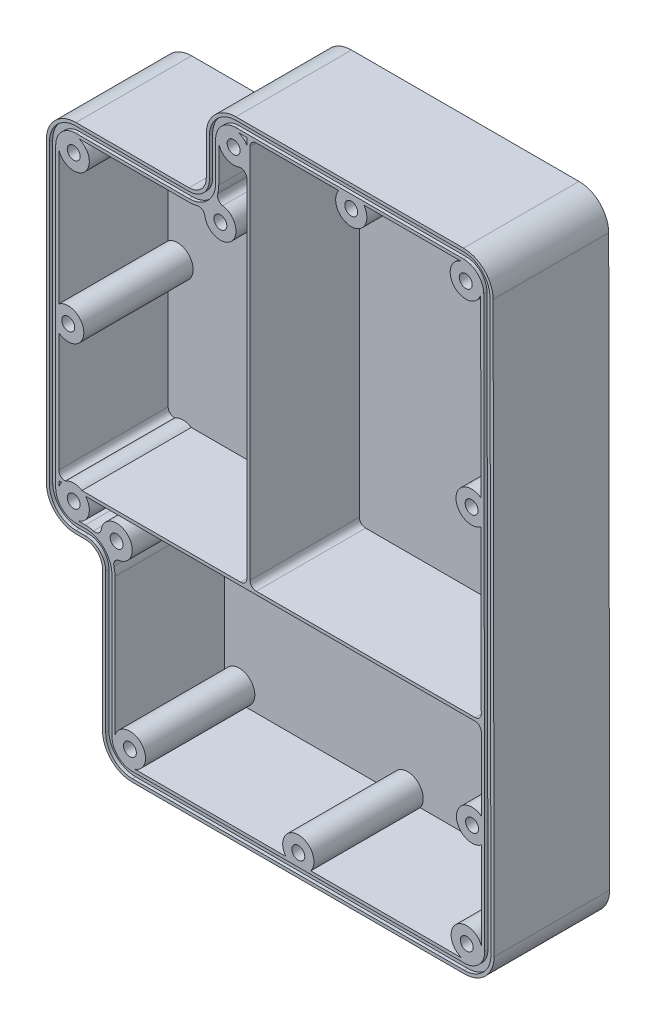
from build123d import *

# Parameters (mm, degrees)
BOSS_EXTRUDE1_DEPTH = 44.45
SHELL1_T            = 2.54
CUT_EXTRUDE1_START  = -1.3208
CUT_EXTRUDE1_DEPTH  = 1.3208
BOSS_EXTRUDE2_DEPTH = 43.1292
BOSS_EXTRUDE3_DEPTH = 44.45
SKETCH11_R          = 2.625
BOSS_EXTRUDE4_DEPTH = 44.45
BOSS_EXTRUDE5_DEPTH = 44.45
FILLET1_R           = 2.54


with BuildPart() as part:
    # Sketch7 → Boss-Extrude1 (new body)
    with BuildSketch(Plane.XY):
        with BuildLine():
            Line((1.400091904, 161.024877954), (93.909764591, 161.024877954))
            ThreePointArc((93.909764591, 161.024877954), (100.639255199, 158.240766705), (103.434750952, 151.515997357))
            Line((103.434750952, 151.515997357), (103.826115978, -79.742350851))
            ThreePointArc((103.826115978, -79.742350851), (101.042018369, -86.487960862), (94.301129617, -89.283470254))
            Line((94.301129617, -89.283470254), (-40.771402015, -89.283470254))
            ThreePointArc((-40.771402015, -89.283470254), (-47.506594106, -86.493662345), (-50.296402015, -79.758470254))
            Line((-50.296402015, -79.758470254), (-50.296402015, -22.862468667))
            ThreePointArc((-50.296402015, -22.862468667), (-53.086209924, -16.127276576), (-59.821402015, -13.337468667))
            Line((-59.821402015, -13.337468667), (-63.623905441, -13.337468667))
            ThreePointArc((-63.623905441, -13.337468667), (-70.359097532, -10.547660758), (-73.148905441, -3.812468667))
            Line((-73.148905441, -3.812468667), (-73.148905441, 116.964531455))
            ThreePointArc((-73.148905441, 116.964531455), (-70.359097532, 123.699723546), (-63.623905441, 126.489531455))
            Line((-63.623905441, 126.489531455), (-17.649908096, 126.489531455))
            ThreePointArc((-17.649908096, 126.489531455), (-10.914716005, 129.279339364), (-8.124908096, 136.014531455))
            Line((-8.124908096, 136.014531455), (-8.124908096, 151.499877954))
            ThreePointArc((-8.124908096, 151.499877954), (-5.335100187, 158.235070045), (1.400091904, 161.024877954))
        make_face()
    extrude(amount=BOSS_EXTRUDE1_DEPTH)

    # Shell1
    shell1_openings = [part.faces().sort_by_distance(p)[0] for p in [
        (21.682405535, 33.552782765, 44.45),
    ]]
    offset(amount=SHELL1_T, openings=shell1_openings, kind=Kind.INTERSECTION)

    # Sketch8 → Cut-Extrude1 (cut)
    with BuildSketch(Plane.XY.offset(44.45).offset(CUT_EXTRUDE1_START)):
        with BuildLine():
            Line((-9.394908096, 151.499877954), (-9.394908096, 136.014531455))
            ThreePointArc((-9.394908096, 136.014531455), (-11.812741617, 130.177364976), (-17.649908096, 127.759531455))
            Line((-17.649908096, 127.759531455), (-63.623905441, 127.759531455))
            ThreePointArc((-63.623905441, 127.759531455), (-71.257123144, 124.597749158), (-74.418905441, 116.964531455))
            Line((-74.418905441, 116.964531455), (-74.418905441, -3.812468667))
            ThreePointArc((-74.418905441, -3.812468667), (-71.257123144, -11.44568637), (-63.623905441, -14.607468667))
            Line((-63.623905441, -14.607468667), (-59.821402015, -14.607468667))
            ThreePointArc((-59.821402015, -14.607468667), (-53.984235537, -17.025302189), (-51.566402015, -22.862468667))
            Line((-51.566402015, -22.862468667), (-51.566402015, -79.758470254))
            ThreePointArc((-51.566402015, -79.758470254), (-48.404619718, -87.391687957), (-40.771402015, -90.553470254))
            Line((-40.771402015, -90.553470254), (94.301129617, -90.553470254))
            ThreePointArc((94.301129617, -90.553470254), (101.940803536, -87.385226277), (105.096114159, -79.740201597))
            Line((105.096114159, -79.740201597), (104.704749133, 151.518146611))
            ThreePointArc((104.704749133, 151.518146611), (101.536520614, 159.139551872), (93.909764591, 162.294877954))
            Line((93.909764591, 162.294877954), (1.400091904, 162.294877954))
            ThreePointArc((1.400091904, 162.294877954), (-6.233125799, 159.133095657), (-9.394908096, 151.499877954))
        make_face()
        with BuildLine():
            Line((-8.124908096, 151.499877954), (-8.124908096, 136.014531455))
            ThreePointArc((-8.124908096, 136.014531455), (-10.914716005, 129.279339364), (-17.649908096, 126.489531455))
            Line((-17.649908096, 126.489531455), (-63.623905441, 126.489531455))
            ThreePointArc((-63.623905441, 126.489531455), (-70.359097532, 123.699723546), (-73.148905441, 116.964531455))
            Line((-73.148905441, 116.964531455), (-73.148905441, -3.812468667))
            ThreePointArc((-73.148905441, -3.812468667), (-70.359097532, -10.547660758), (-63.623905441, -13.337468667))
            Line((-63.623905441, -13.337468667), (-59.821402015, -13.337468667))
            ThreePointArc((-59.821402015, -13.337468667), (-53.086209924, -16.127276576), (-50.296402015, -22.862468667))
            Line((-50.296402015, -22.862468667), (-50.296402015, -79.758470254))
            ThreePointArc((-50.296402015, -79.758470254), (-47.506594106, -86.493662345), (-40.771402015, -89.283470254))
            Line((-40.771402015, -89.283470254), (94.301129617, -89.283470254))
            ThreePointArc((94.301129617, -89.283470254), (101.042018369, -86.487960862), (103.826115978, -79.742350851))
            Line((103.826115978, -79.742350851), (103.434750952, 151.515997357))
            ThreePointArc((103.434750952, 151.515997357), (100.639255199, 158.240766705), (93.909764591, 161.024877954))
            Line((93.909764591, 161.024877954), (1.400091904, 161.024877954))
            ThreePointArc((1.400091904, 161.024877954), (-5.335100187, 158.235070045), (-8.124908096, 151.499877954))
        make_face(mode=Mode.SUBTRACT)
    extrude(amount=CUT_EXTRUDE1_DEPTH, mode=Mode.SUBTRACT)

    # Sketch9 → Boss-Extrude2 (add)
    with BuildSketch(Plane.XY):
        with BuildLine():
            Line((-40.771402015, -89.283470254), (94.301129617, -89.283470254))
            ThreePointArc((94.301129617, -89.283470254), (101.042018369, -86.487960862), (103.826115978, -79.742350851))
            Line((103.826115978, -79.742350851), (103.434750952, 151.515997357))
            ThreePointArc((103.434750952, 151.515997357), (100.639255199, 158.240766705), (93.909764591, 161.024877954))
            Line((93.909764591, 161.024877954), (1.400091904, 161.024877954))
            ThreePointArc((1.400091904, 161.024877954), (-5.335100187, 158.235070045), (-8.124908096, 151.499877954))
            Line((-8.124908096, 151.499877954), (-8.124908096, 136.014531455))
            ThreePointArc((-8.124908096, 136.014531455), (-10.914716005, 129.279339364), (-17.649908096, 126.489531455))
            Line((-17.649908096, 126.489531455), (-63.623905441, 126.489531455))
            ThreePointArc((-63.623905441, 126.489531455), (-70.359097532, 123.699723546), (-73.148905441, 116.964531455))
            Line((-73.148905441, 116.964531455), (-73.148905441, -3.812468667))
            ThreePointArc((-73.148905441, -3.812468667), (-70.359097532, -10.547660758), (-63.623905441, -13.337468667))
            Line((-63.623905441, -13.337468667), (-59.821402015, -13.337468667))
            ThreePointArc((-59.821402015, -13.337468667), (-53.086209924, -16.127276576), (-50.296402015, -22.862468667))
            Line((-50.296402015, -22.862468667), (-50.296402015, -79.758470254))
            ThreePointArc((-50.296402015, -79.758470254), (-47.506594106, -86.493662345), (-40.771402015, -89.283470254))
        make_face()
        with BuildLine():
            Line((-40.771402015, -88.013470254), (94.301129617, -88.013470254))
            ThreePointArc((94.301129617, -88.013470254), (100.143233202, -85.590695448), (102.556117796, -79.744500105))
            Line((102.556117796, -79.744500105), (102.16475277, 151.513848103))
            ThreePointArc((102.16475277, 151.513848103), (99.741989785, 157.341981538), (93.909764591, 159.754877954))
            Line((93.909764591, 159.754877954), (1.400091904, 159.754877954))
            ThreePointArc((1.400091904, 159.754877954), (-4.437074575, 157.337044433), (-6.854908096, 151.499877954))
            Line((-6.854908096, 151.499877954), (-6.854908096, 136.014531455))
            ThreePointArc((-6.854908096, 136.014531455), (-10.016690393, 128.381313752), (-17.649908096, 125.219531455))
            Line((-17.649908096, 125.219531455), (-63.623905441, 125.219531455))
            ThreePointArc((-63.623905441, 125.219531455), (-69.46107192, 122.801697934), (-71.878905441, 116.964531455))
            Line((-71.878905441, 116.964531455), (-71.878905441, -3.812468667))
            ThreePointArc((-71.878905441, -3.812468667), (-69.46107192, -9.649635146), (-63.623905441, -12.067468667))
            Line((-63.623905441, -12.067468667), (-59.821402015, -12.067468667))
            ThreePointArc((-59.821402015, -12.067468667), (-52.188184312, -15.229250964), (-49.026402015, -22.862468667))
            Line((-49.026402015, -22.862468667), (-49.026402015, -79.758470254))
            ThreePointArc((-49.026402015, -79.758470254), (-46.608568494, -85.595636733), (-40.771402015, -88.013470254))
        make_face(mode=Mode.SUBTRACT)
    extrude(amount=BOSS_EXTRUDE2_DEPTH)

    # Sketch10 → Boss-Extrude3 (add)
    with BuildSketch(Plane.XY):
        with BuildLine():
            Line((-40.771402015, -88.013470254), (94.301129617, -88.013470254))
            ThreePointArc((94.301129617, -88.013470254), (100.143233202, -85.590695448), (102.556117796, -79.744500105))
            Line((102.556117796, -79.744500105), (102.16475277, 151.513848103))
            ThreePointArc((102.16475277, 151.513848103), (99.741989785, 157.341981538), (93.909764591, 159.754877954))
            Line((93.909764591, 159.754877954), (1.400091904, 159.754877954))
            ThreePointArc((1.400091904, 159.754877954), (-4.437074575, 157.337044433), (-6.854908096, 151.499877954))
            Line((-6.854908096, 151.499877954), (-6.854908096, 136.014531455))
            ThreePointArc((-6.854908096, 136.014531455), (-10.016690393, 128.381313752), (-17.649908096, 125.219531455))
            Line((-17.649908096, 125.219531455), (-63.623905441, 125.219531455))
            ThreePointArc((-63.623905441, 125.219531455), (-69.46107192, 122.801697934), (-71.878905441, 116.964531455))
            Line((-71.878905441, 116.964531455), (-71.878905441, -3.812468667))
            ThreePointArc((-71.878905441, -3.812468667), (-69.46107192, -9.649635146), (-63.623905441, -12.067468667))
            Line((-63.623905441, -12.067468667), (-59.821402015, -12.067468667))
            ThreePointArc((-59.821402015, -12.067468667), (-52.188184312, -15.229250964), (-49.026402015, -22.862468667))
            Line((-49.026402015, -22.862468667), (-49.026402015, -79.758470254))
            ThreePointArc((-49.026402015, -79.758470254), (-46.608568494, -85.595636733), (-40.771402015, -88.013470254))
        make_face()
        with BuildLine():
            Line((-47.756402015, -22.862468667), (-47.756402015, -79.758470254))
            ThreePointArc((-47.756402015, -79.758470254), (-45.710542882, -84.697611121), (-40.771402015, -86.743470254))
            Line((-40.771402015, -86.743470254), (94.301129617, -86.743470254))
            ThreePointArc((94.301129617, -86.743470254), (99.244448035, -84.693430033), (101.286119615, -79.746649359))
            Line((101.286119615, -79.746649359), (100.894754589, 151.51169885))
            ThreePointArc((100.894754589, 151.51169885), (98.84472437, 156.443196372), (93.909764591, 158.484877954))
            Line((93.909764591, 158.484877954), (1.400091904, 158.484877954))
            ThreePointArc((1.400091904, 158.484877954), (-3.539048963, 156.439018821), (-5.584908096, 151.499877954))
            Line((-5.584908096, 151.499877954), (-5.584908096, 136.014531455))
            ThreePointArc((-5.584908096, 136.014531455), (-9.118664781, 127.48328814), (-17.649908096, 123.949531455))
            Line((-17.649908096, 123.949531455), (-63.623905441, 123.949531455))
            ThreePointArc((-63.623905441, 123.949531455), (-68.563046308, 121.903672321), (-70.608905441, 116.964531455))
            Line((-70.608905441, 116.964531455), (-70.608905441, -3.812468667))
            ThreePointArc((-70.608905441, -3.812468667), (-68.563046308, -8.751609534), (-63.623905441, -10.797468667))
            Line((-63.623905441, -10.797468667), (-59.821402015, -10.797468667))
            ThreePointArc((-59.821402015, -10.797468667), (-51.2901587, -14.331225352), (-47.756402015, -22.862468667))
        make_face(mode=Mode.SUBTRACT)
    extrude(amount=BOSS_EXTRUDE3_DEPTH)

    # Sketch11 → Boss-Extrude4 (add)
    # profile 1 of 13: a face of its own
    with BuildSketch(Plane.XY):
        with BuildLine():
            Line((53.373686264, 158.484877954), (43.213686264, 158.484877954))
            ThreePointArc((43.213686264, 158.484877954), (48.293686264, 148.324877954), (53.373686264, 158.484877954))
        make_face()
        with Locations(Location((48.293686264, 154.674877954, 0), (0, 0, 180))):
            Circle(SKETCH11_R, mode=Mode.SUBTRACT)
    # profile 2 of 13: a face of its own
    with BuildSketch(Plane.XY):
        with BuildLine():
            ThreePointArc((-5.584908096, 150.488909584), (4.947066292, 147.952903566), (2.411060274, 158.484877954))
            Line((2.411060274, 158.484877954), (1.400091904, 158.484877954))
            ThreePointArc((1.400091904, 158.484877954), (-3.539048963, 156.439018821), (-5.584908096, 151.499877954))
            Line((-5.584908096, 151.499877954), (-5.584908096, 150.488909584))
        make_face()
        with Locations(Location((0.456938231, 152.443031627, 0), (0, 0, 180))):
            Circle(SKETCH11_R, mode=Mode.SUBTRACT)
    # profile 3 of 13: a face of its own
    with BuildSketch(Plane.XY):
        with BuildLine():
            Line((93.909764591, 158.484877954), (92.906312255, 158.484877954))
            ThreePointArc((92.906312255, 158.484877954), (90.363717533, 147.959501952), (100.896515499, 150.471173688))
            Line((100.896515499, 150.471173688), (100.894754589, 151.51169885))
            ThreePointArc((100.894754589, 151.51169885), (98.84472437, 156.443196372), (93.909764591, 158.484877954))
        make_face()
        with Locations(Location((94.860434298, 152.443031627, 0), (0, 0, 180))):
            Circle(SKETCH11_R, mode=Mode.SUBTRACT)
    # profile 4 of 13: a face of its own
    with BuildSketch(Plane.XY):
        with BuildLine():
            ThreePointArc((-10.545215193, 126.263246219), (-0.441087381, 118.80571074), (-7.89862286, 128.909838552))
            ThreePointArc((-7.89862286, 128.909838552), (-9.118664781, 127.48328814), (-10.545215193, 126.263246219))
        make_face()
        with Locations(Location((-4.931215441, 123.2958388, 0), (0, 0, 180))):
            Circle(SKETCH11_R, mode=Mode.SUBTRACT)
    # profile 5 of 13: a face of its own
    with BuildSketch(Plane.XY):
        with BuildLine():
            Line((101.034415828, 68.985603235), (101.017221826, 79.145572319))
            ThreePointArc((101.017221826, 79.145572319), (90.865822465, 74.048393729), (101.034415828, 68.985603235))
        make_face()
        with Locations(Location((97.215813371, 74.059139997, 0), (0, 0, 180))):
            Circle(SKETCH11_R, mode=Mode.SUBTRACT)
    # profile 6 of 13: a face of its own
    with BuildSketch(Plane.XY):
        with BuildLine():
            ThreePointArc((-70.608905441, 115.953563085), (-60.076931053, 113.417557067), (-62.612937071, 123.949531455))
            Line((-62.612937071, 123.949531455), (-63.623905441, 123.949531455))
            ThreePointArc((-63.623905441, 123.949531455), (-68.563046308, 121.903672321), (-70.608905441, 116.964531455))
            Line((-70.608905441, 116.964531455), (-70.608905441, 115.953563085))
        make_face()
        with Locations(Location((-64.567059114, 117.907685127, 0), (0, 0, 180))):
            Circle(SKETCH11_R, mode=Mode.SUBTRACT)
    # profile 7 of 13: a face of its own
    with BuildSketch(Plane.XY):
        with BuildLine():
            Line((101.223858494, -42.956432762), (101.206664491, -32.796463679))
            ThreePointArc((101.206664491, -32.796463679), (91.05526513, -37.893642269), (101.223858494, -42.956432762))
        make_face()
        with Locations(Location((97.405256037, -37.882896, 0), (0, 0, 180))):
            Circle(SKETCH11_R, mode=Mode.SUBTRACT)
    # profile 8 of 13: a face of its own
    with BuildSketch(Plane.XY):
        with BuildLine():
            ThreePointArc((-70.608905441, 51.496031394), (-60.448905441, 56.576031394), (-70.608905441, 61.656031394))
            Line((-70.608905441, 61.656031394), (-70.608905441, 51.496031394))
        make_face()
        with Locations(Location((-66.798905441, 56.576031394, 0), (0, 0, 180))):
            Circle(SKETCH11_R, mode=Mode.SUBTRACT)
    # profile 9 of 13: a face of its own
    with BuildSketch(Plane.XY):
        with BuildLine():
            Line((101.286119615, -79.746649359), (101.284459543, -78.765709666))
            ThreePointArc((101.284459543, -78.765709666), (90.753394024, -76.204738493), (93.282632484, -86.743470254))
            Line((93.282632484, -86.743470254), (94.301129617, -86.743470254))
            ThreePointArc((94.301129617, -86.743470254), (99.244448035, -84.693430033), (101.286119615, -79.746649359))
        make_face()
        with Locations(Location((95.236754526, -80.701623927, 0), (0, 0, 180))):
            Circle(SKETCH11_R, mode=Mode.SUBTRACT)
    # profile 10 of 13: a face of its own
    with BuildSketch(Plane.XY):
        with BuildLine():
            ThreePointArc((-62.612937071, -10.797468667), (-60.076931053, -0.265494279), (-70.608905441, -2.801500297))
            Line((-70.608905441, -2.801500297), (-70.608905441, -3.812468667))
            ThreePointArc((-70.608905441, -3.812468667), (-68.563046308, -8.751609534), (-63.623905441, -10.797468667))
            Line((-63.623905441, -10.797468667), (-62.612937071, -10.797468667))
        make_face()
        with Locations(Location((-64.567059114, -4.75562234, 0), (0, 0, 180))):
            Circle(SKETCH11_R, mode=Mode.SUBTRACT)
    # profile 11 of 13: a face of its own
    with BuildSketch(Plane.XY):
        with BuildLine():
            Line((21.681099419, -86.743470254), (31.841099419, -86.743470254))
            ThreePointArc((31.841099419, -86.743470254), (26.761099419, -76.583470254), (21.681099419, -86.743470254))
        make_face()
        with Locations(Location((26.761099419, -82.933470254, 0), (0, 0, 180))):
            Circle(SKETCH11_R, mode=Mode.SUBTRACT)
    # profile 12 of 13: a face of its own
    with BuildSketch(Plane.XY):
        with BuildLine():
            Line((-40.771402015, -86.743470254), (-39.760433645, -86.743470254))
            ThreePointArc((-39.760433645, -86.743470254), (-37.224427627, -76.211495866), (-47.756402015, -78.747501884))
            Line((-47.756402015, -78.747501884), (-47.756402015, -79.758470254))
            ThreePointArc((-47.756402015, -79.758470254), (-45.710542882, -84.697611121), (-40.771402015, -86.743470254))
        make_face()
        with Locations(Location((-41.714555688, -80.701623927, 0), (0, 0, 180))):
            Circle(SKETCH11_R, mode=Mode.SUBTRACT)
    # profile 13 of 13: a face of its own
    with BuildSketch(Plane.XY):
        with BuildLine():
            ThreePointArc((-50.070116779, -15.757775764), (-42.6125813, -5.653647952), (-52.716709112, -13.111183431))
            ThreePointArc((-52.716709112, -13.111183431), (-51.2901587, -14.331225352), (-50.070116779, -15.757775764))
        make_face()
        with Locations(Location((-47.102709361, -10.143776013, 0), (0, 0, 180))):
            Circle(SKETCH11_R, mode=Mode.SUBTRACT)
    extrude(amount=BOSS_EXTRUDE4_DEPTH)

    # Sketch12 → Boss-Extrude5 (add)
    with BuildSketch(Plane.XY):
        Polygon((7.115091904, 158.484877954), (5.845091904, 158.484877954), (5.845091904, 0.632531333), (-70.608905441, 0.632531333), (-70.608905441, -0.637468667), (101.152240917, -0.637468667), (101.152240917, 0.632531333), (7.115091904, 0.632531333), align=None)
    extrude(amount=BOSS_EXTRUDE5_DEPTH)

    # Fillet1
    fillet1_edges = [part.edges().sort_by_distance(p)[0] for p in [
        (-50.070116779, -15.757775764, 22.225),
        (-52.716709112, -13.111183431, 22.225),
        (-10.545215193, 126.263246219, 22.225),
        (-7.89862286, 128.909838552, 22.225),
        (5.845091904, 149.082927462, 22.225),
        (5.845091904, 0.632531333, 22.225),
        (7.115091904, 158.484877954, 22.225),
        (-70.608905441, 0.632531333, 22.225),
        (101.152240917, -0.637468667, 22.225),
        (101.15009166, 0.632531333, 22.225),
        (7.115091904, 0.632531333, 22.225),
    ]]
    fillet(fillet1_edges, radius=FILLET1_R)


solid = part.part
